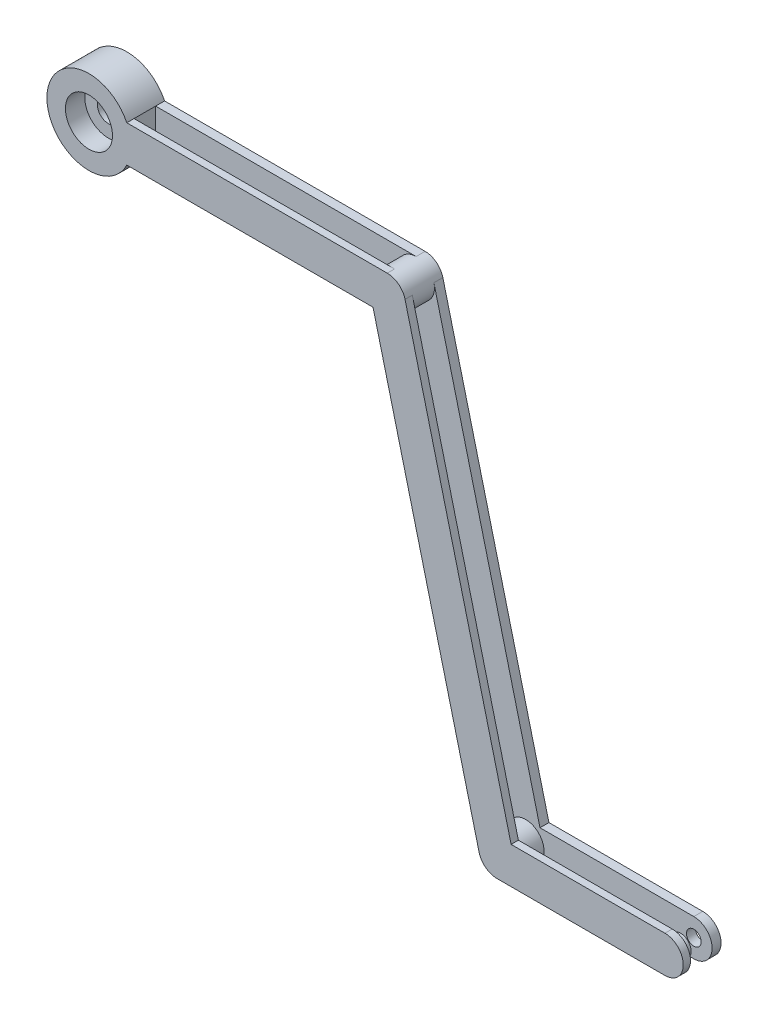
from build123d import *
from build123d.topology import SkipClean

# Parameters (mm, degrees)
EXTRUDE_1_DEPTH          = 9
SKETCH_2_R               = 5.6
CUT_EXTRUDE_1_DEPTH      = 4.6
SKETCH_3_R               = 2.6
CUT_EXTRUDE_2_DEPTH      = 178.798114195
SKETCH_5_W               = 132.43986789
SKETCH_5_H               = 5.139725872
CUT_EXTRUDE_3_DEPTH      = 181.463576917
EXTRUDE_START            = -7.270147681
SKETCH_6_R               = 4.358898944
EXTRUDE_2_DEPTH          = 7.270147681
SKETCH_7_R               = 4.358898944
EXTRUDE_3_DEPTH          = 7.270147681
SKETCH_8_R               = 2.5
EXTRUDE_4_DEPTH          = 2
CUT_EXTRUDE_4_REACH      = 179.798
SKETCH_9_R               = 1.75
CUT_EXTRUDE_5_DEPTH      = 181.463576917
CUT_EXTRUDE_5_DEPTH_BACK = 181.463576917
SKETCH_12_W              = 151.43986789
SKETCH_12_H              = 9


with BuildPart() as part:
    # 草图1 → 凸台-拉伸1 (new body)
    with BuildSketch(Plane.XY):
        with BuildLine():
            Line((97.080968947, -107.358898944), (137.080968947, -107.358898944))
            ThreePointArc((137.080968947, -107.358898944), (141.43986789, -103), (137.080968947, -98.641101056))
            Line((137.080968947, -98.641101056), (100.473705575, -98.641101056))
            Line((100.473705575, -98.641101056), (75.225539013, 1.069962639))
            ThreePointArc((75.225539013, 1.069962639), (73.67732525, 3.439757187), (71, 4.358898944))
            Line((71, 4.358898944), (9, 4.358898944))
            ThreePointArc((9, 4.358898944), (-10, 0), (9, -4.358898944))
            Line((9, -4.358898944), (67.607263372, -4.358898944))
            Line((67.607263372, -4.358898944), (92.855429934, -104.069962639))
            ThreePointArc((92.855429934, -104.069962639), (94.403643697, -106.439757187), (97.080968947, -107.358898944))
        make_face()
    extrude(amount=EXTRUDE_1_DEPTH)

    # 草图2 → 切除-拉伸1 (cut)
    with BuildSketch(Plane(origin=(0, 0, 0), x_dir=(-1, 0, 0), z_dir=(0, 0, -1))):
        Circle(SKETCH_2_R)
    extrude(amount=-CUT_EXTRUDE_1_DEPTH, mode=Mode.SUBTRACT)

    # 草图3 → 切除-拉伸2 (cut, through all)
    with BuildSketch(Plane.XY.offset(9)):
        Circle(SKETCH_3_R)
    extrude(amount=-CUT_EXTRUDE_2_DEPTH, mode=Mode.SUBTRACT)

    # 草图5 → 切除-拉伸3 (cut, through all)
    with BuildSketch(Plane(origin=(0, 4.358898944, 0), x_dir=(1, 0, 0), z_dir=(0, 1, 0))):
        with Locations((75.219933945, -4.299715255)):
            Rectangle(SKETCH_5_W, SKETCH_5_H)
    extrude(amount=-CUT_EXTRUDE_3_DEPTH, mode=Mode.SUBTRACT)

    # 草图6 → 凸台-拉伸2 (add)
    with SkipClean():  # the faces are left unmerged after this step: merging them gives an invalid solid
        with BuildSketch(Plane.XY.offset(9).offset(EXTRUDE_START)):
            with Locations(Location((71, 0, 0), (0, 0, 90))):
                Circle(SKETCH_6_R)
        extrude(amount=EXTRUDE_2_DEPTH)

    # 草图7 → 凸台-拉伸3 (add)
    with SkipClean():  # the faces are left unmerged after this step: merging them gives an invalid solid
        with BuildSketch(Plane.XY.offset(9).offset(EXTRUDE_START)):
            with Locations(Location((97.080968947, -103, 0), (0, 0, 194.209390146))):
                Circle(SKETCH_7_R)
        extrude(amount=EXTRUDE_3_DEPTH)

    # 草图8 → 凸台-拉伸4 (add)
    with SkipClean():  # the faces are left unmerged after this step: merging them gives an invalid solid
        with BuildSketch(Plane.XY.offset(1.729852319)):
            with Locations(Location((137.080968947, -103, 0), (0, 0, 180))):
                Circle(SKETCH_8_R)
        extrude(amount=EXTRUDE_4_DEPTH)

    # 草图9 → 切除-拉伸4 (cut, up to next)
    with BuildSketch(Plane.XY.offset(9), mode=Mode.PRIVATE) as cut_extrude_4_sk1:
        with Locations((137.080968947, -103)):
            Circle(SKETCH_9_R)
    cut_extrude_4_tool1 = extrude(cut_extrude_4_sk1.sketch, amount=-CUT_EXTRUDE_4_REACH, mode=Mode.PRIVATE) & part.part
    add(cut_extrude_4_tool1.solids().sort_by_distance((137.080969, -103, 9))[0], mode=Mode.SUBTRACT)

    # 镜向8: part across plane


with BuildPart() as part_1:
    add(part.part)
    add(part.part.mirror(Plane.XY))

    # 草图12 → 切除-拉伸5 (cut, two sides: drawn at the far end of the back side and taken through both)
    with BuildSketch(Plane(origin=(0, 4.358898944, 0), x_dir=(1, 0, 0), z_dir=(0, 1, 0)).offset(-CUT_EXTRUDE_5_DEPTH_BACK)):
        with Locations((65.719933945, -4.5)):
            Rectangle(SKETCH_12_W, SKETCH_12_H)
    extrude(amount=CUT_EXTRUDE_5_DEPTH + CUT_EXTRUDE_5_DEPTH_BACK, mode=Mode.SUBTRACT)


solid = part_1.part
